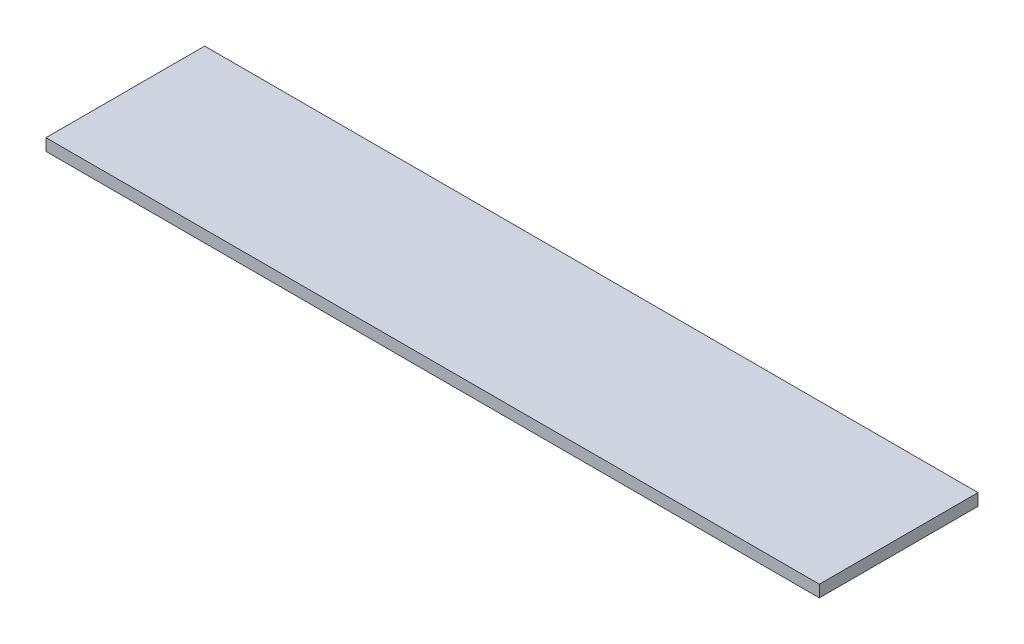
from build123d import *

# Parameters (mm, degrees)
CROQUIS1_W              = 1170
CROQUIS1_H              = 240
SALIENTE_EXTRUIR1_DEPTH = 18


with BuildPart() as part:
    # Croquis1 → Saliente-Extruir1 (new body)
    with BuildSketch(Plane(origin=(0, 0, 0), x_dir=(1, 0, 0), z_dir=(0, 1, 0))):
        Rectangle(CROQUIS1_W, CROQUIS1_H)
    extrude(amount=SALIENTE_EXTRUIR1_DEPTH)


solid = part.part
